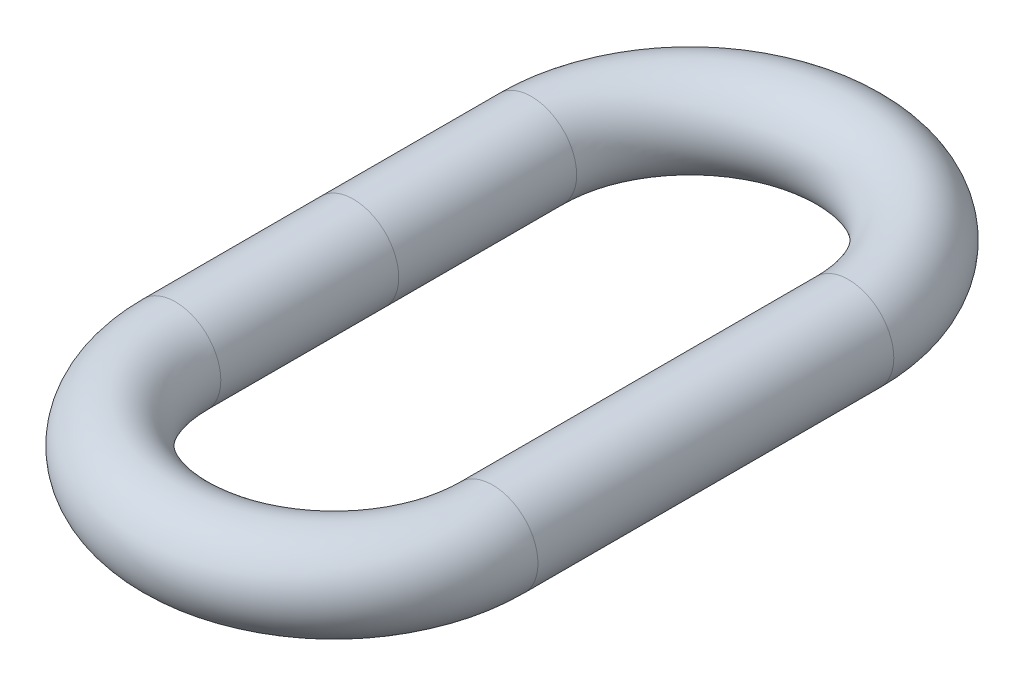
from build123d import *

# Parameters (mm, degrees)
SKETCH2_R = 25.4


with BuildPart() as part:
    # Sweep1: sweep along a path in Sketch1
    with BuildLine(Plane(origin=(0, 0, 0), x_dir=(1, 0, 0), z_dir=(0, 1, 0))) as sweep1_path:
        Line((-114.3, -99.745330847), (-114.3, 99.745330847))
        ThreePointArc((-114.3, 99.745330847), (0, 214.045330847), (114.3, 99.745330847))
        Line((114.3, 99.745330847), (114.3, -99.745330847))
        ThreePointArc((114.3, -99.745330847), (0, -214.045330847), (-114.3, -99.745330847))
    # Sketch2 → Sweep1 (sweep)
    with BuildSketch(Plane.XY):
        with Locations((-88.9, 25.4)):
            Circle(SKETCH2_R)
    sweep(path=sweep1_path.line)


solid = part.part
